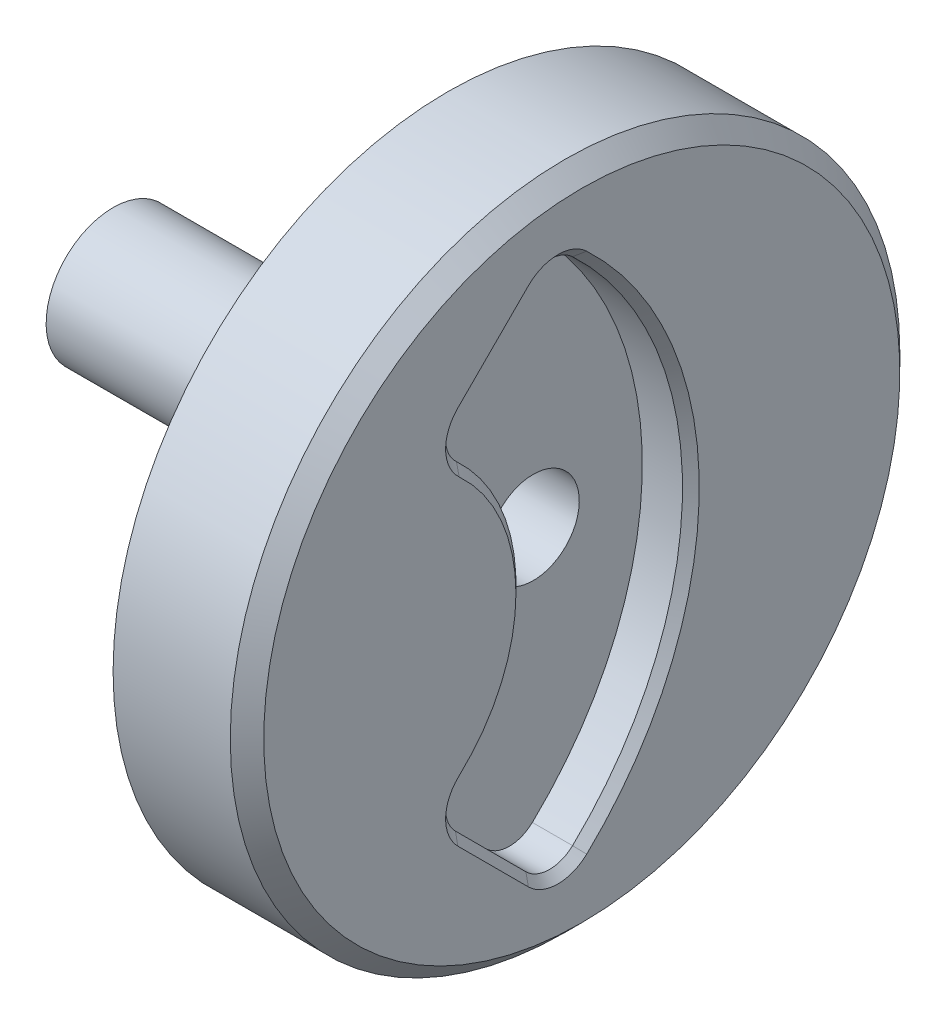
from build123d import *

# Parameters (mm, degrees)
CORTAR_EXTRUIR1_DEPTH = 2.9
REDONDEO1_R           = 10
CORTAR_EXTRUIR2_REACH = 41.799
CROQUIS3_R            = 1.75
CROQUIS4_R            = 2.75
CORTAR_EXTRUIR3_DEPTH = 22.1
CHAFL_N1_SIZE         = 1
CHAFL_N2_SIZE         = 0.5


with BuildPart() as part:
    # Croquis1 → Revolución1 (revolve)
    with BuildSketch(Plane.XY):
        Polygon((-20, 0), (-20, 4), (0, 4), (0, 20), (8, 20), (8, 0), align=None)
    revolve(axis=Axis((8, 0, 0), (-1, 0, 0)))

    # Croquis2 → Cortar-Extruir1 (cut)
    with BuildSketch(Plane(origin=(8, 0, 0), x_dir=(0, 0, -1), z_dir=(1, 0, 0))):
        with BuildLine():
            Line((-2.839199656, 15.194118815), (-7.049029232, 10.984289239))
            ThreePointArc((-7.049029232, 10.984289239), (-7.634375098, 9.528098398), (-6.988431485, 8.097756342))
            ThreePointArc((-6.988431485, 8.097756342), (-3.433318471, 0), (-6.988431485, -8.097756342))
            ThreePointArc((-6.988431485, -8.097756342), (-7.634375098, -9.528098398), (-7.049029232, -10.984289239))
            Line((-7.049029232, -10.984289239), (-2.839199656, -15.194118815))
            ThreePointArc((-2.839199656, -15.194118815), (-1.453779812, -15.779697972), (-0.052075025, -15.234248815))
            ThreePointArc((-0.052075025, -15.234248815), (6.516681529, 0), (-0.052075025, 15.234248815))
            ThreePointArc((-0.052075025, 15.234248815), (-1.453779812, 15.779697972), (-2.839199656, 15.194118815))
        make_face()
    extrude(amount=-CORTAR_EXTRUIR1_DEPTH, mode=Mode.SUBTRACT)

    # Redondeo1
    redondeo1_edges = [part.edges().sort_by_distance(p)[0] for p in [
        (0, -4, 0),
    ]]
    fillet(redondeo1_edges, radius=REDONDEO1_R)

    # Croquis3 → Cortar-Extruir2 (cut, up to next)
    with BuildSketch(Plane.ZY.offset(20), mode=Mode.PRIVATE) as cortar_extruir2_sk1:
        with Locations(Location((0, 0, 0), (0, 0, 270))):
            Circle(CROQUIS3_R)
    cortar_extruir2_tool1 = extrude(cortar_extruir2_sk1.sketch, amount=-CORTAR_EXTRUIR2_REACH, mode=Mode.PRIVATE) & part.part
    add(cortar_extruir2_tool1.solids().sort_by_distance((-20, 0, 0))[0], mode=Mode.SUBTRACT)

    # Croquis4 → Cortar-Extruir3 (cut)
    with BuildSketch(Plane(origin=(5.1, 0, 0), x_dir=(0, 0, -1), z_dir=(1, 0, 0))):
        with Locations(Location((0, 0, 0), (0, 0, 90))):
            Circle(CROQUIS4_R)
    extrude(amount=-CORTAR_EXTRUIR3_DEPTH, mode=Mode.SUBTRACT)

    # Chaflán1
    chafl_n1_edges = [part.edges().sort_by_distance(p)[0] for p in [
        (8, -20, 0),
    ]]
    chamfer(chafl_n1_edges, length=CHAFL_N1_SIZE)

    # Chaflán2
    chafl_n2_edges = [part.edges().sort_by_distance(p)[0] for p in [
        (8, -15.779697972, 1.453779812),
        (8, 0, -6.516681529),
        (8, 15.779697972, 1.453779812),
        (8, 13.089204027, 4.944114444),
        (8, 9.528098398, 7.634375098),
        (8, 0, 3.433318471),
        (8, -9.528098398, 7.634375098),
        (8, -13.089204027, 4.944114444),
    ]]
    chamfer(chafl_n2_edges, length=CHAFL_N2_SIZE)


solid = part.part
